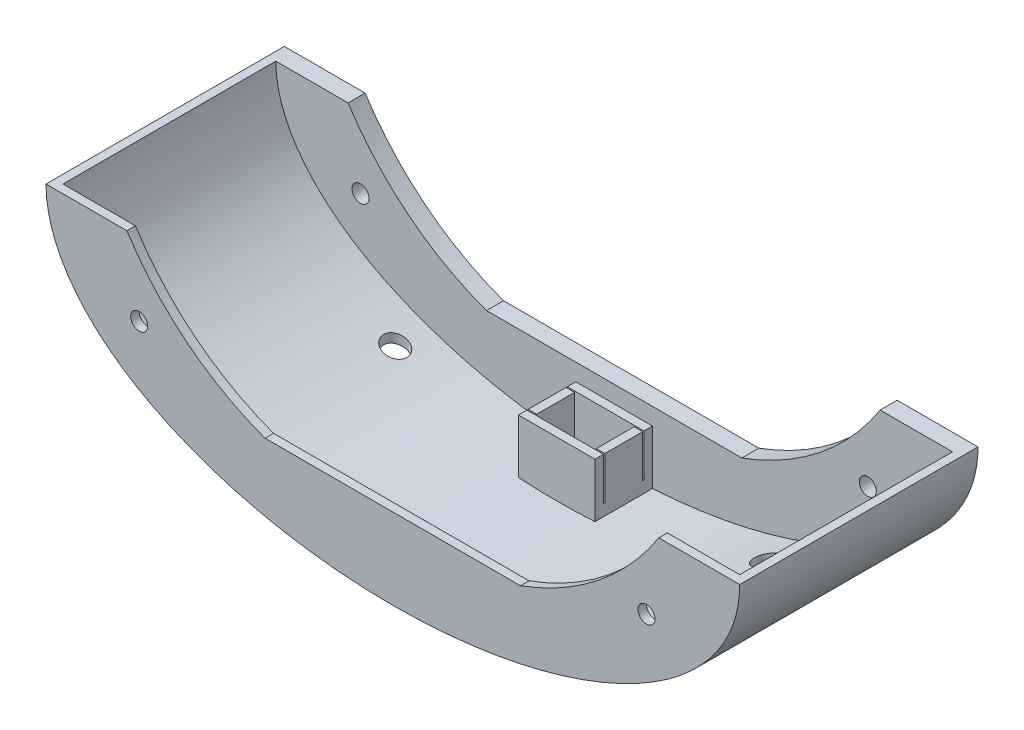
from build123d import *

# Parameters (mm, degrees)
CROQUIS1_R                 = 2
SALIENTE_EXTRUIR1_DEPTH    = 4
SALIENTE_EXTRUIR4_DEPTH    = 50
SALIENTE_EXTRUIR5_DEPTH    = 50
CROQUIS11_W                = 2
CROQUIS11_H                = 8.9
SALIENTE_EXTRUIR9_DEPTH    = 10
SALIENTE_EXTRUIR10_REACH   = 107.633
CROQUIS11_3_W              = 18
CROQUIS11_3_H              = 13.5
CROQUIS11_3_W_2            = 14
CROQUIS11_3_H_2            = 9.5
CROQUIS12_W                = 14
CROQUIS12_H                = 9.5
CORTAR_EXTRUIR4_DEPTH      = 103.265585771
CROQUIS13_R                = 2
SALIENTE_EXTRUIR11_DEPTH   = 2
CORTAR_EXTRUIR5_DEPTH      = 107.668880352
CORTAR_EXTRUIR5_DEPTH_BACK = 107.668880352
CROQUIS14_R                = 2.75


with BuildPart() as part:
    # Croquis1 → Saliente-Extruir1 (new body)
    # profile 1 of 2: a face of its own
    with BuildSketch(Plane.XY):
        with BuildLine():
            Line((-76.5, 40), (-62.5, 40))
            ThreePointArc((-62.5, 40), (-48.387263047, 24.328421191), (-30, 14))
            Line((-30, 14), (0, 14))
            Line((0, 14), (30, 14))
            ThreePointArc((30, 14), (48.387263047, 24.328421191), (62.5, 40))
            Line((62.5, 40), (76.5, 40))
            add(Edge.make_bspline(
                [(-76.5, 40), (-76.5, 0), (0, 0), (76.5, 0), (76.5, 40)],
                knots=[3.141592654, 3.141592654, 3.141592654, 4.71238898, 4.71238898, 6.283185307, 6.283185307, 6.283185307], degree=2, weights=[1, 0.707106781, 1, 0.707106781, 1]))
        make_face()
        with Locations((59.6, 23)):
            Circle(CROQUIS1_R, mode=Mode.SUBTRACT)
        with Locations((-59.6, 23)):
            Circle(CROQUIS1_R, mode=Mode.SUBTRACT)
    # profile 2 of 2: a face of its own
    with BuildSketch(Plane.XY):
        with BuildLine():
            Line((-81.5, 40), (-76.5, 40))
            add(Edge.make_bspline(
                [(-76.5, 40), (-76.5, 0), (0, 0), (76.5, 0), (76.5, 40)],
                knots=[3.141592654, 3.141592654, 3.141592654, 4.71238898, 4.71238898, 6.283185307, 6.283185307, 6.283185307], degree=2, weights=[1, 0.707106781, 1, 0.707106781, 1]))
            Line((76.5, 40), (81.5, 40))
            add(Edge.make_bspline(
                [(-81.5, 40), (-81.5, 36.750529527), (-80.260995736, 30.280968201), (-73.321740908, 18.442769728), (-57.739765713, 6.428777931), (-31.065541534, -2.851449154), (0, -6.074275423), (31.065541534, -2.851449154), (57.739765713, 6.428777931), (73.321740908, 18.442769728), (80.260995736, 30.280968201), (81.5, 36.750529527), (81.5, 40)],
                knots=[3.141592654, 3.141592654, 3.141592654, 3.141592654, 3.337942194, 3.534291735, 3.926990817, 4.319689899, 4.71238898, 5.105088062, 5.497787144, 5.890486225, 6.086835766, 6.283185307, 6.283185307, 6.283185307, 6.283185307], degree=3))
        make_face()
    extrude(amount=SALIENTE_EXTRUIR1_DEPTH)

    # Croquis3 → Saliente-Extruir4 (add)
    with BuildSketch(Plane.XY.offset(4)):
        with BuildLine():
            Line((-79.5, 40), (-81.5, 40))
            add(Edge.make_bspline(
                [(-81.5, 40), (-81.5, 36.750529527), (-80.260995736, 30.280968201), (-73.321740908, 18.442769728), (-57.739765713, 6.428777931), (-31.065541534, -2.851449154), (0, -6.074275423), (31.065541534, -2.851449154), (57.739765713, 6.428777931), (73.321740908, 18.442769728), (80.260995736, 30.280968201), (81.5, 36.750529527), (81.5, 40)],
                knots=[3.141592654, 3.141592654, 3.141592654, 3.141592654, 3.337942194, 3.534291735, 3.926990817, 4.319689899, 4.71238898, 5.105088062, 5.497787144, 5.890486225, 6.086835766, 6.283185307, 6.283185307, 6.283185307, 6.283185307], degree=3))
            Line((81.5, 40), (79.5, 40))
            add(Edge.make_bspline(
                [(-79.5, 40), (-79.5, 36.991341109), (-78.362139989, 31.031676499), (-73.4854296, 22.67698029), (-65.86257571, 15.23476419), (-52.477867818, 6.72993781), (-30.654961286, -0.878496362), (0, -4.060751819), (30.654961286, -0.878496362), (52.477867818, 6.72993781), (65.86257571, 15.23476419), (73.4854296, 22.67698029), (78.362139989, 31.031676499), (79.5, 36.991341109), (79.5, 40)],
                knots=[3.141592654, 3.141592654, 3.141592654, 3.141592654, 3.337942194, 3.534291735, 3.730641276, 3.926990817, 4.319689899, 4.71238898, 5.105088062, 5.497787144, 5.694136685, 5.890486225, 6.086835766, 6.283185307, 6.283185307, 6.283185307, 6.283185307], degree=3))
        make_face()
    extrude(amount=SALIENTE_EXTRUIR4_DEPTH)

    # Croquis4 → Saliente-Extruir5 (add)
    with BuildSketch(Plane.XY.offset(4)):
        with BuildLine():
            add(Edge.make_bspline(
                [(-79.5, 40), (-79.5, 36.991341109), (-78.362139989, 31.031676499), (-73.4854296, 22.67698029), (-65.86257571, 15.23476419), (-52.477867818, 6.72993781), (-30.654961286, -0.878496362), (0, -4.060751819), (30.654961286, -0.878496362), (52.477867818, 6.72993781), (65.86257571, 15.23476419), (73.4854296, 22.67698029), (78.362139989, 31.031676499), (79.5, 36.991341109), (79.5, 40)],
                knots=[3.141592654, 3.141592654, 3.141592654, 3.141592654, 3.337942194, 3.534291735, 3.730641276, 3.926990817, 4.319689899, 4.71238898, 5.105088062, 5.497787144, 5.694136685, 5.890486225, 6.086835766, 6.283185307, 6.283185307, 6.283185307, 6.283185307], degree=3))
            Line((79.5, 40), (81.5, 40))
            add(Edge.make_bspline(
                [(-81.5, 40), (-81.5, 36.750529527), (-80.260995736, 30.280968201), (-73.321740908, 18.442769728), (-57.739765713, 6.428777931), (-31.065541534, -2.851449154), (0, -6.074275423), (31.065541534, -2.851449154), (57.739765713, 6.428777931), (73.321740908, 18.442769728), (80.260995736, 30.280968201), (81.5, 36.750529527), (81.5, 40)],
                knots=[3.141592654, 3.141592654, 3.141592654, 3.141592654, 3.337942194, 3.534291735, 3.926990817, 4.319689899, 4.71238898, 5.105088062, 5.497787144, 5.890486225, 6.086835766, 6.283185307, 6.283185307, 6.283185307, 6.283185307], degree=3))
            Line((-81.5, 40), (-79.5, 40))
        make_face()
    extrude(amount=SALIENTE_EXTRUIR5_DEPTH)

    # Croquis11 → Saliente-Extruir9 (add)
    with BuildSketch(Plane(origin=(0, 0, 0), x_dir=(1, 0, 0), z_dir=(0, 1, 0))):
        Polygon((-7, -15.5), (-9, -15.5), (-9, -17.5), (9, -17.5), (9, -15.5), (7, -15.5), align=None)
        with Locations((8, -10.75)):
            Rectangle(CROQUIS11_W, CROQUIS11_H)
        with Locations((-8, -10.75)):
            Rectangle(CROQUIS11_W, CROQUIS11_H)
        Polygon((9, -4), (-9, -4), (-9, -6), (-7, -6), (7, -6), (9, -6), align=None)
    extrude(amount=SALIENTE_EXTRUIR9_DEPTH)


with BuildPart() as saliente_extruir9_piece_1:
    # of the separate pieces the step leaves, piece 1, a body of its own (saliente_extruir9_pieces)
    add(part.part.solids().sort_by_distance((81.5, 40, 0))[0])

    # Croquis11<3> → Saliente-Extruir10 (add, up to next)
    with BuildSketch(Plane(origin=(0, 0, 0), x_dir=(1, 0, 0), z_dir=(0, 1, 0)), mode=Mode.PRIVATE) as saliente_extruir10_sk1:
        with Locations((0, -10.75)):
            Rectangle(CROQUIS11_3_W, CROQUIS11_3_H)
        with Locations((0, -10.75)):
            Rectangle(CROQUIS11_3_W_2, CROQUIS11_3_H_2, mode=Mode.SUBTRACT)
    saliente_extruir10_tool1 = extrude(saliente_extruir10_sk1.sketch, amount=-SALIENTE_EXTRUIR10_REACH, mode=Mode.PRIVATE) - saliente_extruir9_piece_1.part


with BuildPart() as saliente_extruir9_piece_2:
    # of the separate pieces the step leaves, piece 2, a body of its own (saliente_extruir9_pieces)
    add(part.part.solids().sort_by_distance((9, 0, 15.5))[0])


with BuildPart() as saliente_extruir9_piece_3:
    # of the separate pieces the step leaves, piece 3, a body of its own (saliente_extruir9_pieces)
    add(part.part.solids().sort_by_distance((7, 0, 15.2))[0])


with BuildPart() as saliente_extruir9_piece_4:
    # of the separate pieces the step leaves, piece 4, a body of its own (saliente_extruir9_pieces)
    add(part.part.solids().sort_by_distance((-9, 0, 15.2))[0])


with BuildPart() as saliente_extruir9_piece_1_1:
    add(saliente_extruir9_piece_1.part)

    add(saliente_extruir9_piece_2.part)  # Saliente-Extruir10 merges Saliente-Extruir9 piece 2

    add(saliente_extruir9_piece_3.part)  # Saliente-Extruir10 merges Saliente-Extruir9 piece 3

    add(saliente_extruir9_piece_4.part)  # Saliente-Extruir10 merges Saliente-Extruir9 piece 4
    add(saliente_extruir10_tool1.solids().sort_by_distance((0, 0, 4.225))[0])

    # Croquis12 → Cortar-Extruir4 (cut, through all)
    with BuildSketch(Plane(origin=(0, 10, 0), x_dir=(1, 0, 0), z_dir=(0, 1, 0))):
        with Locations((0, -10.75)):
            Rectangle(CROQUIS12_W, CROQUIS12_H)
    extrude(amount=-CORTAR_EXTRUIR4_DEPTH, mode=Mode.SUBTRACT)

    # Croquis13 → Saliente-Extruir11 (add)
    with BuildSketch(Plane.XY.offset(54)):
        with BuildLine():
            Line((81.5, 40), (79.5, 40))
            Line((79.5, 40), (62.5, 40))
            ThreePointArc((62.5, 40), (48.387263047, 24.328421191), (30, 14))
            Line((30, 14), (-30, 14))
            ThreePointArc((-30, 14), (-48.387263047, 24.328421191), (-62.5, 40))
            Line((-62.5, 40), (-79.5, 40))
            Line((-79.5, 40), (-81.5, 40))
            add(Edge.make_bspline(
                [(-81.5, 40), (-81.5, 36.750529527), (-80.260995736, 30.280968201), (-73.321740908, 18.442769728), (-57.739765713, 6.428777931), (-31.065541534, -2.851449154), (0, -6.074275423), (31.065541534, -2.851449154), (57.739765713, 6.428777931), (73.321740908, 18.442769728), (80.260995736, 30.280968201), (81.5, 36.750529527), (81.5, 40)],
                knots=[3.141592654, 3.141592654, 3.141592654, 3.141592654, 3.337942194, 3.534291735, 3.926990817, 4.319689899, 4.71238898, 5.105088062, 5.497787144, 5.890486225, 6.086835766, 6.283185307, 6.283185307, 6.283185307, 6.283185307], degree=3))
        make_face()
        with Locations((-59.6, 23)):
            Circle(CROQUIS13_R, mode=Mode.SUBTRACT)
        with Locations((59.6, 23)):
            Circle(CROQUIS13_R, mode=Mode.SUBTRACT)
    extrude(amount=SALIENTE_EXTRUIR11_DEPTH)

    # Croquis14 → Cortar-Extruir5 (cut, two sides: drawn at the far end of the back side and taken through both)
    with BuildSketch(Plane(origin=(0, 0, 0), x_dir=(1, 0, 0), z_dir=(0, 1, 0)).offset(-CORTAR_EXTRUIR5_DEPTH_BACK)):
        with Locations(Location((-43.540491997, -11.892319133, 0), (0, 0, 270))):
            Circle(CROQUIS14_R)
        with Locations(Location((43.540491997, -11.892319133, 0), (0, 0, 270))):
            Circle(CROQUIS14_R)
    extrude(amount=CORTAR_EXTRUIR5_DEPTH + CORTAR_EXTRUIR5_DEPTH_BACK, mode=Mode.SUBTRACT)


solid = saliente_extruir9_piece_1_1.part
